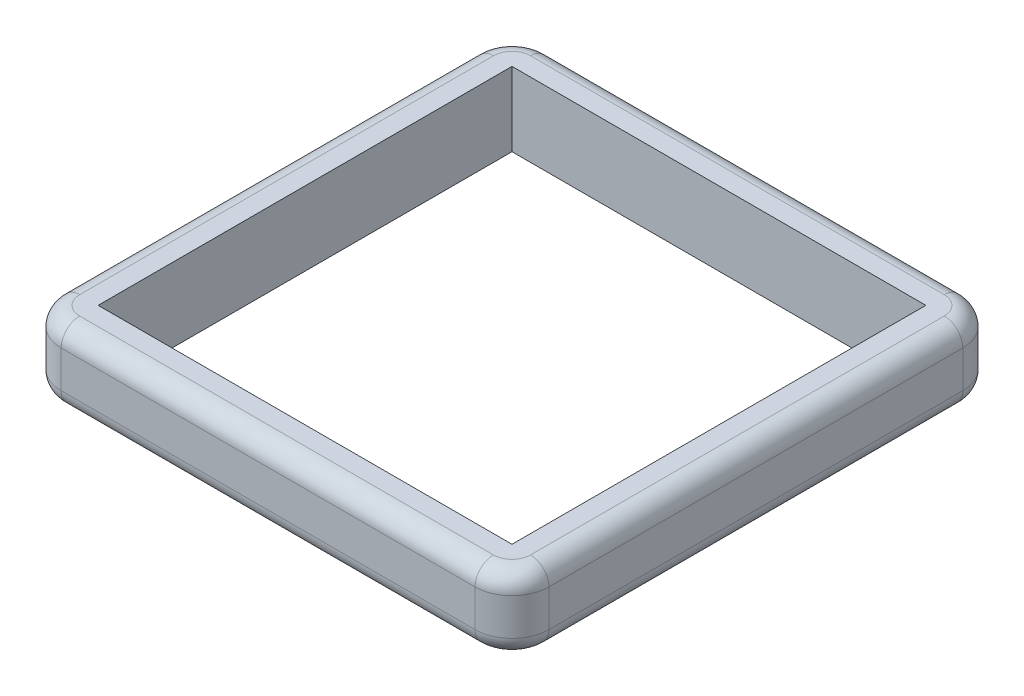
from build123d import *

# Parameters (mm, degrees)
BOSS_EXTRUDE1_DEPTH = 711.2
REVOLVE13_ANGLE     = 90
REVOLVE12_ANGLE     = 90
BOSS_EXTRUDE3_DEPTH = 711.2
REVOLVE2_ANGLE      = 90
BOSS_EXTRUDE4_DEPTH = 711.2
REVOLVE10_ANGLE     = 90
BOSS_EXTRUDE5_DEPTH = 711.2


with BuildPart() as part:
    # Sketch1 → Boss-Extrude1 (new body)
    with BuildSketch(Plane(origin=(0, 0, 0), x_dir=(0, 0, -1), z_dir=(1, 0, 0))):
        with BuildLine():
            ThreePointArc((0, 31.75), (-22.450640303, 22.450640303), (-31.75, 0))
            Line((-31.75, 0), (-31.75, -63.5))
            ThreePointArc((-31.75, -63.5), (-22.450640303, -85.950640303), (0, -95.25))
            Line((0, -95.25), (31.75, -95.25))
            Line((31.75, -95.25), (31.75, 0))
            Line((31.75, 0), (31.75, 31.75))
            Line((31.75, 31.75), (0, 31.75))
        make_face()
    extrude(amount=BOSS_EXTRUDE1_DEPTH)



with BuildPart() as body_2:
    # Sketch8 → Revolve13 (revolve)
    with BuildSketch(Plane(origin=(711.2, 0, 0), x_dir=(0, 0, -1), z_dir=(1, 0, 0))):
        with BuildLine():
            Line((-31.75, 0), (-31.75, -63.5))
            ThreePointArc((-31.75, -63.5), (-22.450640303, -85.950640303), (0, -95.25))
            Line((0, -95.25), (31.75, -95.25))
            Line((31.75, -95.25), (31.75, 31.75))
            Line((31.75, 31.75), (0, 31.75))
            ThreePointArc((0, 31.75), (-22.450640303, 22.450640303), (-31.75, 0))
        make_face()
    revolve(axis=Axis((711.2, -95.25, -31.75), (0, 1, 0)), revolution_arc=REVOLVE13_ANGLE)


with BuildPart() as body_3:
    # Sketch15 → Revolve12 (revolve)
    with BuildSketch(Plane(origin=(0, 0, -31.75), x_dir=(0, 0, 1), z_dir=(-1, 0, 0))):
        with BuildLine():
            ThreePointArc((31.75, -95.25), (54.200640303, -85.950640303), (63.5, -63.5))
            Line((63.5, -63.5), (63.5, 0))
            ThreePointArc((63.5, 0), (54.200640303, 22.450640303), (31.75, 31.75))
            Line((31.75, 31.75), (0, 31.75))
            Line((0, 31.75), (0, -95.25))
            Line((0, -95.25), (31.75, -95.25))
        make_face()
    revolve(axis=Axis((0, 31.75, -31.75), (0, -1, 0)), revolution_arc=REVOLVE12_ANGLE)


with BuildPart() as part_1:
    add(part.part)

    add(body_2.part)  # Boss-Extrude3 merges body 2
    # Sketch7 → Boss-Extrude3 (add)
    with BuildSketch(Plane(origin=(0, 0, -31.75), x_dir=(-1, 0, 0), z_dir=(0, 0, -1))):
        with BuildLine():
            ThreePointArc((-742.95, 31.75), (-765.400640303, 22.450640303), (-774.7, 0))
            Line((-774.7, 0), (-774.7, -63.5))
            ThreePointArc((-774.7, -63.5), (-765.400640303, -85.950640303), (-742.95, -95.25))
            Line((-742.95, -95.25), (-711.2, -95.25))
            Line((-711.2, -95.25), (-711.2, 31.75))
            Line((-711.2, 31.75), (-742.95, 31.75))
        make_face()
    extrude(amount=BOSS_EXTRUDE3_DEPTH)

    # Sketch12 → Revolve2 (revolve)
    with BuildSketch(Plane(origin=(1454.15, 0, -742.95), x_dir=(-1, 0, 0), z_dir=(0, 0, -1))):
        with BuildLine():
            ThreePointArc((711.2, 31.75), (688.749359697, 22.450640303), (679.45, 0))
            Line((679.45, 0), (679.45, -63.5))
            ThreePointArc((679.45, -63.5), (688.749359697, -85.950640303), (711.2, -95.25))
            Line((711.2, -95.25), (742.95, -95.25))
            Line((742.95, -95.25), (742.95, 31.75))
            Line((742.95, 31.75), (711.2, 31.75))
        make_face()
    revolve(axis=Axis((711.2, -95.25, -742.95), (0, 1, 0)), revolution_arc=REVOLVE2_ANGLE)


    add(body_3.part)  # Boss-Extrude4 merges body 3
    # Sketch9 → Boss-Extrude4 (add)
    with BuildSketch(Plane(origin=(0, 0, -31.75), x_dir=(-1, 0, 0), z_dir=(0, 0, -1))):
        with BuildLine():
            Line((0, 31.75), (0, -95.25))
            Line((0, -95.25), (31.75, -95.25))
            ThreePointArc((31.75, -95.25), (54.200640303, -85.950640303), (63.5, -63.5))
            Line((63.5, -63.5), (63.5, 0))
            ThreePointArc((63.5, 0), (54.200640303, 22.450640303), (31.75, 31.75))
            Line((31.75, 31.75), (0, 31.75))
        make_face()
    extrude(amount=BOSS_EXTRUDE4_DEPTH)


with BuildPart() as body_2_2:
    # Sketch14 → Revolve10 (revolve)
    with BuildSketch(Plane(origin=(0, 0, -742.95), x_dir=(-1, 0, 0), z_dir=(0, 0, -1))):
        with BuildLine():
            Line((31.75, 31.75), (0, 31.75))
            Line((0, 31.75), (0, -95.25))
            Line((0, -95.25), (31.75, -95.25))
            ThreePointArc((31.75, -95.25), (54.200640303, -85.950640303), (63.5, -63.5))
            Line((63.5, -63.5), (63.5, 0))
            ThreePointArc((63.5, 0), (54.200640303, 22.450640303), (31.75, 31.75))
        make_face()
    revolve(axis=Axis((0, 31.75, -742.95), (0, -1, 0)), revolution_arc=REVOLVE10_ANGLE)


with BuildPart() as body_3_2:
    # Sketch10 → Boss-Extrude5 (new body)
    with BuildSketch(Plane(origin=(0, 0, 0), x_dir=(0, 0, -1), z_dir=(1, 0, 0))):
        with BuildLine():
            ThreePointArc((806.45, 0), (797.150640303, 22.450640303), (774.7, 31.75))
            Line((774.7, 31.75), (742.95, 31.75))
            Line((742.95, 31.75), (742.95, -95.25))
            Line((742.95, -95.25), (774.7, -95.25))
            ThreePointArc((774.7, -95.25), (797.150640303, -85.950640303), (806.45, -63.5))
            Line((806.45, -63.5), (806.45, 0))
        make_face()
    extrude(amount=BOSS_EXTRUDE5_DEPTH)


with BuildPart() as part_2:
    add(part_1.part)

    # Combine1: union body 3 2, body 2 2
    add(body_3_2.part)
    add(body_2_2.part)


solid = part_2.part
